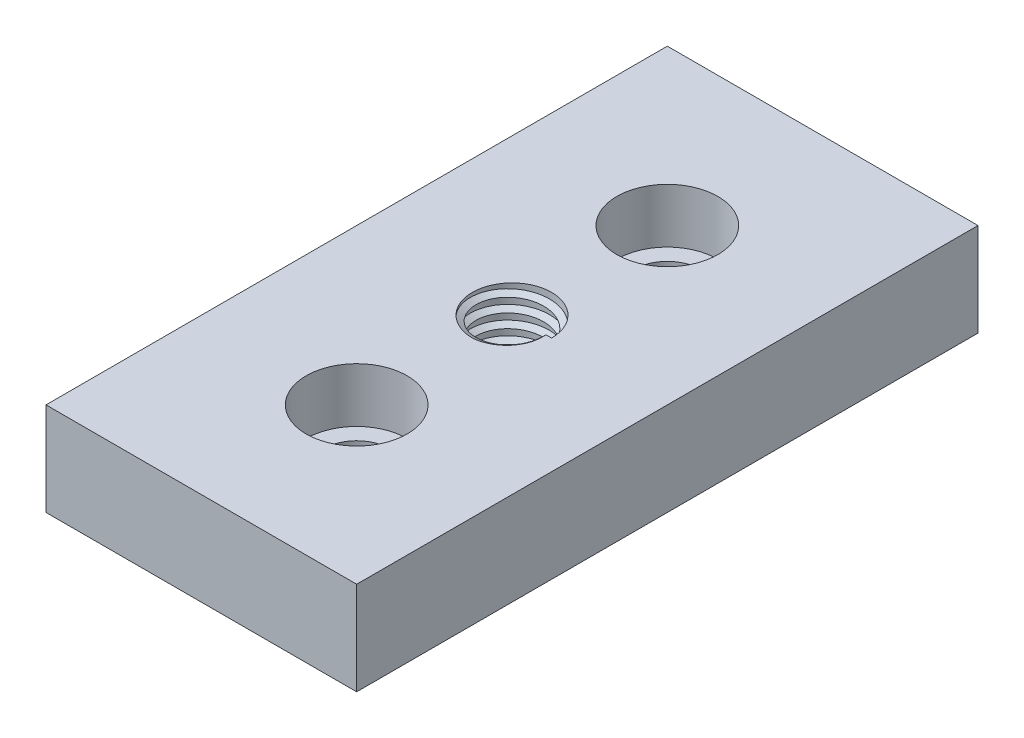
from build123d import *

# Parameters (mm, degrees)
SKETCH_1_W          = 40
SKETCH_1_H          = 80
SKETCH_1_R          = 4.25
SKETCH_1_R_2        = 5.1
EXTRUDE_1_DEPTH     = 12
SKETCH_3_R          = 6.5
CUT_EXTRUDE_1_DEPTH = 7
SWEEP_1_PITCH       = 1.75
SWEEP_1_HEIGHT      = 12
SWEEP_1_RADIUS      = 5.1
SWEEP_1_START_ANGLE = 90
SKETCH_6_W          = 42.021889548
SKETCH_6_H          = 2.845778449
SKETCH_6_W_2        = 42.914668854
SKETCH_6_H_2        = 10.152042119
CUT_EXTRUDE_2_DEPTH = 91.331481783


with BuildPart() as part:
    # 草图1 → 凸台-拉伸1 (new body)
    with BuildSketch(Plane(origin=(0, 0, 0), x_dir=(1, 0, 0), z_dir=(0, 1, 0))):
        with Locations((20, 40)):
            Rectangle(SKETCH_1_W, SKETCH_1_H)
        with Locations(Location((20, 60, 0), (0, 0, 270))):
            Circle(SKETCH_1_R, mode=Mode.SUBTRACT)
        with Locations(Location((20, 20, 0), (0, 0, 270))):
            Circle(SKETCH_1_R, mode=Mode.SUBTRACT)
        with Locations(Location((20, 40, 0), (0, 0, 270))):
            Circle(SKETCH_1_R_2, mode=Mode.SUBTRACT)
    extrude(amount=EXTRUDE_1_DEPTH)

    # 草图3 → 切除-拉伸1 (cut)
    with BuildSketch(Plane(origin=(0, 12, 0), x_dir=(1, 0, 0), z_dir=(0, 1, 0))):
        with Locations(Location((20, 20, 0), (0, 0, 270))):
            Circle(SKETCH_3_R)
        with Locations(Location((20, 60, 0), (0, 0, 270))):
            Circle(SKETCH_3_R)
    extrude(amount=-CUT_EXTRUDE_1_DEPTH, mode=Mode.SUBTRACT)

    # 扫描1: sweep along a helix
    with BuildLine() as sweep_1_path:
        add(Helix(SWEEP_1_PITCH, SWEEP_1_HEIGHT, SWEEP_1_RADIUS, center=(20, 12, -40), direction=(0, -1, 0), mode=Mode.PRIVATE).rotate(Axis((20, 12, -40), (0, -1, 0)), SWEEP_1_START_ANGLE))
    # 草图5 → 扫描1 (sweep)
    with BuildSketch(Plane(origin=(25.1, 12, -40), x_dir=(1, 0, 0), z_dir=(5.189082450239955e-15, -0.054530732695540304, 0.9985120926617203))):
        Polygon((-0.740428606, 0), (0.370214303, -0.641229983), (0.370214303, 0.641229983), align=None)
    sweep(path=sweep_1_path.line, is_frenet=True)

    # 草图6 → 切除-拉伸2 (cut, through all)
    with BuildSketch(Plane(origin=(0, 0, -80), x_dir=(-1, 0, 0), z_dir=(0, 0, -1))):
        with Locations((-18.989055226, 13.422889225)):
            Rectangle(SKETCH_6_W, SKETCH_6_H)
        with Locations((-18.542665573, -5.07602106)):
            Rectangle(SKETCH_6_W_2, SKETCH_6_H_2)
    extrude(amount=-CUT_EXTRUDE_2_DEPTH, mode=Mode.SUBTRACT)


solid = part.part
